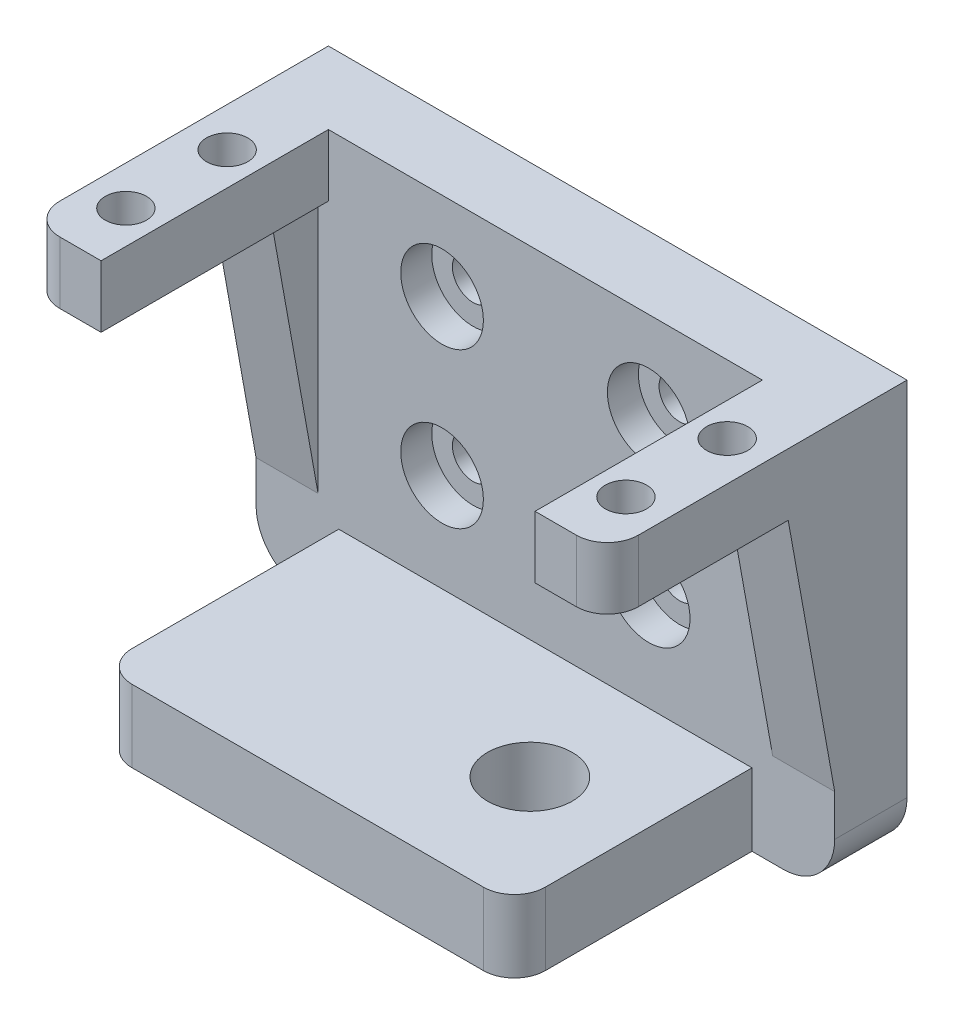
from build123d import *

# Parameters (mm, degrees)
EXTRUDE_START       = 74.5
SKETCH_4_R          = 2
EXTRUDE_1_DEPTH     = 6
SKETCH_5_W          = 40
SKETCH_5_H          = 34
SKETCH_5_R          = 2
EXTRUDE_2_DEPTH     = 7
CUT_EXTRUDE_START   = -21.5
SKETCH_6_R          = 4
CUT_EXTRUDE_1_DEPTH = 3
EXTRUDE_START_2     = 40.5
SKETCH_7_R          = 4.1
EXTRUDE_3_DEPTH     = 7
SKETCH_8_R          = 4.9
CUT_EXTRUDE_2_DEPTH = 0.9
EXTRUDE_START_3     = 2
EXTRUDE_4_DEPTH     = 6
EXTRUDE_5_DEPTH     = 6
SKETCH_13_W         = 30
SKETCH_13_H         = 25
EXTRUDE_6_DEPTH     = 7


with BuildPart() as part:
    # 草图4 → 凸台-拉伸1 (new body)
    with BuildSketch(Plane(origin=(0, 0, 0), x_dir=(1, 0, 0), z_dir=(0, 1, 0)).offset(EXTRUDE_START)):
        with BuildLine():
            Line((-28, 28.5), (28, 28.5))
            Line((28, 28.5), (28, 2.5))
            ThreePointArc((28, 2.5), (27.121320344, 0.378679656), (25, -0.5))
            Line((25, -0.5), (21, -0.5))
            Line((21, -0.5), (21, 21.5))
            Line((21, 21.5), (-21, 21.5))
            Line((-21, 21.5), (-21, -0.5))
            Line((-21, -0.5), (-25, -0.5))
            ThreePointArc((-25, -0.5), (-27.121320344, 0.378679656), (-28, 2.5))
            Line((-28, 2.5), (-28, 28.5))
        make_face()
        with Locations(Location((-24.2, 14.9, 0), (0, 0, 90))):
            Circle(SKETCH_4_R, mode=Mode.SUBTRACT)
        with Locations(Location((-24.2, 5.1, 0), (0, 0, 90))):
            Circle(SKETCH_4_R, mode=Mode.SUBTRACT)
        with Locations(Location((24.2, 14.9, 0), (0, 0, 90))):
            Circle(SKETCH_4_R, mode=Mode.SUBTRACT)
        with Locations(Location((24.2, 5.1, 0), (0, 0, 90))):
            Circle(SKETCH_4_R, mode=Mode.SUBTRACT)
    extrude(amount=EXTRUDE_1_DEPTH)

    # 草图5 → 凸台-拉伸2 (add)
    with BuildSketch(Plane(origin=(0, 0, -28.5), x_dir=(-1, 0, 0), z_dir=(0, 0, -1))):
        with Locations((0, 57.5)):
            Rectangle(SKETCH_5_W, SKETCH_5_H)
        with Locations((-10, 72)):
            Circle(SKETCH_5_R, mode=Mode.SUBTRACT)
        with Locations(Location((10, 72, 0), (0, 0, 180))):
            Circle(SKETCH_5_R, mode=Mode.SUBTRACT)
        with Locations((10, 57)):
            Circle(SKETCH_5_R, mode=Mode.SUBTRACT)
        with Locations(Location((-10, 57, 0), (0, 0, 180))):
            Circle(SKETCH_5_R, mode=Mode.SUBTRACT)
    extrude(amount=-EXTRUDE_2_DEPTH)

    # 草图6 → 切除-拉伸1 (cut)
    with BuildSketch(Plane.XY.offset(CUT_EXTRUDE_START)):
        with Locations((-10, 72)):
            Circle(SKETCH_6_R)
        with Locations((10, 72)):
            Circle(SKETCH_6_R)
        with Locations((-10, 57)):
            Circle(SKETCH_6_R)
        with Locations((10, 57)):
            Circle(SKETCH_6_R)
    extrude(amount=-CUT_EXTRUDE_1_DEPTH, mode=Mode.SUBTRACT)

    # 草图7 → 凸台-拉伸3 (add)
    with BuildSketch(Plane(origin=(0, 0, 0), x_dir=(1, 0, 0), z_dir=(0, 1, 0)).offset(EXTRUDE_START_2)):
        with BuildLine():
            Line((20, 21.5), (-20, 21.5))
            Line((-20, 21.5), (-20, 1.5))
            ThreePointArc((-20, 1.5), (-19.121320344, -0.621320344), (-17, -1.5))
            Line((-17, -1.5), (17, -1.5))
            ThreePointArc((17, -1.5), (19.121320344, -0.621320344), (20, 1.5))
            Line((20, 1.5), (20, 21.5))
        make_face()
        with Locations(Location((10, 10, 0), (0, 0, 90))):
            Circle(SKETCH_7_R, mode=Mode.SUBTRACT)
    extrude(amount=EXTRUDE_3_DEPTH)

    # 草图8 → 切除-拉伸2 (cut)
    with BuildSketch(Plane.XZ.offset(-40.5)):
        with Locations(Location((10, -10, 0), (0, 0, 270))):
            Circle(SKETCH_8_R)
    extrude(amount=-CUT_EXTRUDE_2_DEPTH, mode=Mode.SUBTRACT)

    # 草图10 → 凸台-拉伸4 (add)
    with BuildSketch(Plane(origin=(20, 0, 0), x_dir=(0, 0, -1), z_dir=(1, 0, 0)).offset(EXTRUDE_START_3)):
        Polygon((28.5, 49.5), (28.5, 74.5), (17, 74.5), (21.5, 49.5), align=None)
    extrude(amount=EXTRUDE_4_DEPTH)

    # 草图12 → 凸台-拉伸5 (add)
    with BuildSketch(Plane.ZY.offset(20).offset(EXTRUDE_START_3)):
        Polygon((-21.5, 49.5), (-28.5, 49.5), (-28.5, 74.5), (-17, 74.5), align=None)
    extrude(amount=EXTRUDE_5_DEPTH)

    # 草图13 → 凸台-拉伸6 (add)
    with BuildSketch(Plane(origin=(0, 0, -28.5), x_dir=(-1, 0, 0), z_dir=(0, 0, -1))):
        with BuildLine():
            Line((28, 80.5), (-28, 80.5))
            Line((-28, 80.5), (-28, 45.5))
            ThreePointArc((-28, 45.5), (-26.535533906, 41.964466094), (-23, 40.5))
            Line((-23, 40.5), (23, 40.5))
            ThreePointArc((23, 40.5), (26.535533906, 41.964466094), (28, 45.5))
            Line((28, 45.5), (28, 80.5))
        make_face()
        with Locations((0, 65)):
            Rectangle(SKETCH_13_W, SKETCH_13_H, mode=Mode.SUBTRACT)
    extrude(amount=-EXTRUDE_6_DEPTH)


solid = part.part
